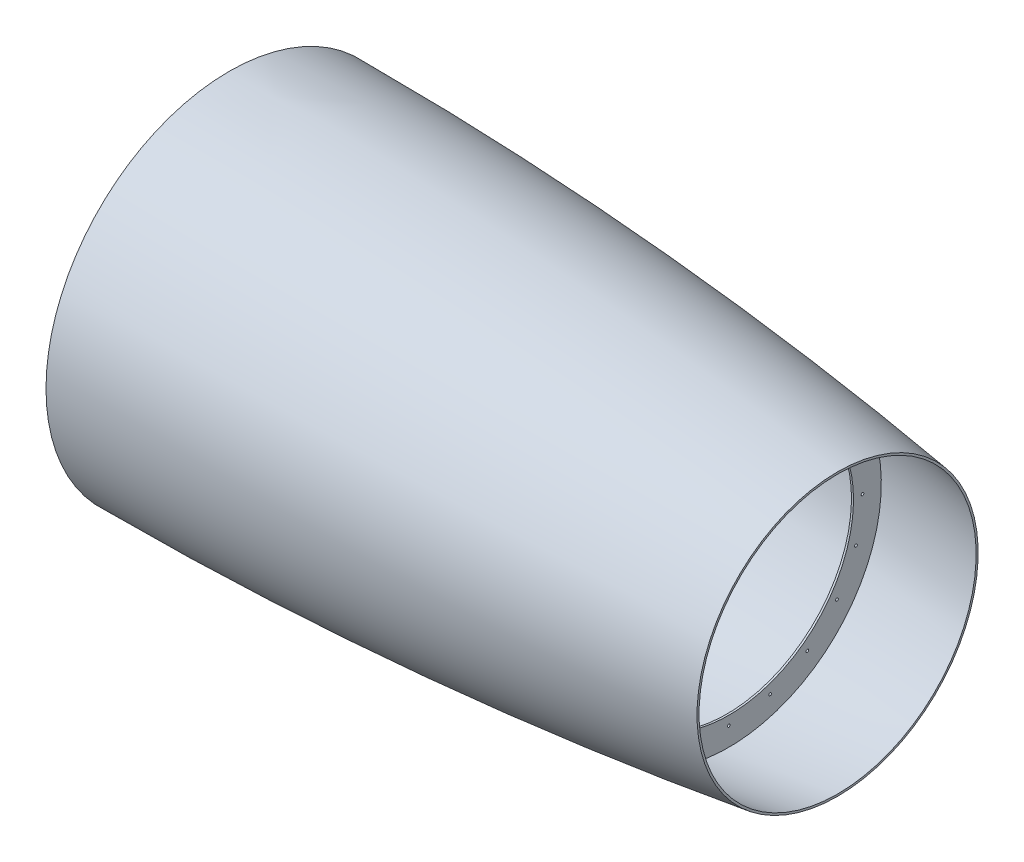
from build123d import *

# Parameters (mm, degrees)
SKETCH2_R          = 4
CUT_EXTRUDE1_DEPTH = 10
SKETCH3_R          = 2
CUT_EXTRUDE2_DEPTH = 10
CIRPATTERN1_COUNT  = 20


with BuildPart() as part:
    # Sketch1 → Revolve1 (revolve)
    with BuildSketch(Plane.XY):
        with BuildLine():
            Line((-455, 274), (-454.99913421, 271.000000125))
            Line((-454.99913421, 271.000000125), (-454.99913421, 244.75))
            Line((-454.99913421, 244.75), (-451.99913421, 244.75))
            Line((-451.99913421, 244.75), (-451.99913421, 271.000173287))
            ThreePointArc((-451.99913421, 271.000173287), (-384.845486833, 270.641481951), (-317.69913421, 269.588702271))
            Line((-317.69913421, 269.588702271), (-317.69913421, 225))
            Line((-317.69913421, 225), (-314.69913421, 225))
            Line((-314.69913421, 225), (-314.69913421, 269.525462894))
            ThreePointArc((-314.69913421, 269.525462894), (-12.220347003, 256.022552407), (289.30086579, 228.441697853))
            Line((289.30086579, 228.441697853), (289.30086579, 186.5))
            Line((289.30086579, 186.5), (292.30086579, 186.5))
            Line((292.30086579, 186.5), (292.30086579, 228.095915066))
            ThreePointArc((292.30086579, 228.095915066), (373.716317714, 218.171581754), (455, 207.220271439))
            Line((455, 207.220271439), (455, 210.25))
            ThreePointArc((455, 210.25), (1.119739337, 258.10873014), (-455, 274))
        make_face()
    revolve(axis=Axis((455, 0, 0), (-1, 0, 0)))

    # Sketch2 → Cut-Extrude1 (cut)
    with BuildSketch(Plane.ZY.offset(454.99913421)):
        with Locations(Location((40, 256.904651573, 0), (0, 0, 270))):
            Circle(SKETCH2_R)
    cut_extrude1 = extrude(amount=-CUT_EXTRUDE1_DEPTH, mode=Mode.SUBTRACT)

    # Sketch3 → Cut-Extrude2 (cut)
    with BuildSketch(Plane(origin=(292.30086579, 0, 0), x_dir=(0, 0, -1), z_dir=(1, 0, 0))):
        with Locations(Location((0, 200, 0), (0, 0, 90))):
            Circle(SKETCH3_R)
    cut_extrude2 = extrude(amount=-CUT_EXTRUDE2_DEPTH, mode=Mode.SUBTRACT)

    # CirPattern1: Cut-Extrude1, Cut-Extrude2 ×20 about axis
    cirpattern1_axis = Axis((0, 0, 0), (1, 0, 0))
    add([cut_extrude1.rotate(cirpattern1_axis, i * 360 / CIRPATTERN1_COUNT) for i in range(1, CIRPATTERN1_COUNT)], mode=Mode.SUBTRACT)
    add([cut_extrude2.rotate(cirpattern1_axis, i * 360 / CIRPATTERN1_COUNT) for i in range(1, CIRPATTERN1_COUNT)], mode=Mode.SUBTRACT)


solid = part.part
